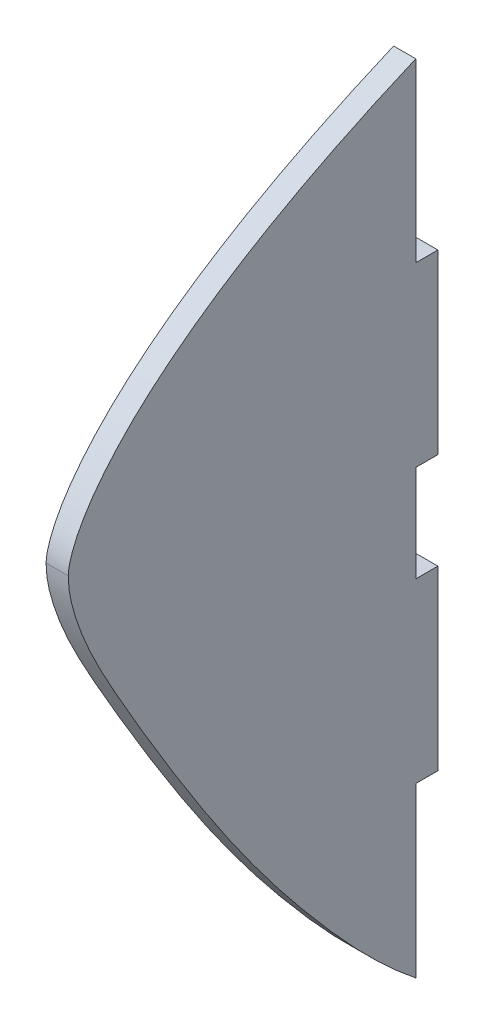
from build123d import *

# Parameters (mm, degrees)
BOSS_EXTRUDE1_DEPTH = 3.175


with BuildPart() as part:
    # Sketch1 → Boss-Extrude1 (new body)
    with BuildSketch(Plane(origin=(38.1, 0, 0), x_dir=(0, 0, -1), z_dir=(1, 0, 0))):
        with BuildLine():
            Line((53.975, 13.934655528), (50.8, 13.934655528))
            Line((50.8, 13.934655528), (50.8, 39.248123167))
            add(Edge.make_bspline(
                [(50.8, 39.248123167), (50.114337, 38.95697122), (45.517089309, 36.98001911), (37.125857024, 33.052669943), (27.830125776, 27.881863583), (20.719091236, 23.242106564), (15.614494654, 19.455138907), (10.786662405, 15.322065366), (6.429542578, 10.752123034), (3.32977957, 6.520652954), (1.7663924, 3.289417246), (1.234577983, 1.629552847), (1.070915718, 0.808496426), (1.022678144, 0.373573946), (1.007771389, 0.114040702), (1.000919428, -0.010571554)],
                knots=[0.920379078, 0.920379078, 0.920379078, 0.920379078, 0.923068011, 0.938443771, 0.95381953, 0.96150741, 0.96919529, 0.97688317, 0.984571049, 0.992258929, 0.996102869, 0.998024839, 0.998985824, 0.999466316, 0.999946809, 0.999946809, 0.999946809, 0.999946809], degree=3))
            add(Edge.make_bspline(
                [(1.000919428, -0.010571554), (1.009921864, -0.277884035), (1.028925425, -0.823363517), (1.10276659, -1.825860568), (1.41675837, -3.59720545), (2.452149912, -7.203198014), (4.557689087, -12.131447527), (7.694251284, -17.873839822), (12.081450574, -25.466402985), (17.732187967, -34.796472344), (24.919918009, -45.768226926), (31.457639598, -54.481002451), (37.047634728, -61.182548528), (42.818130244, -67.680088504), (47.457882264, -72.162847135), (50.8, -74.824969829)],
                knots=[5.1726e-05, 5.1726e-05, 5.1726e-05, 5.1726e-05, 0.001013083, 0.00197444, 0.003897153, 0.00774258, 0.015433433, 0.023124286, 0.030815139, 0.046196845, 0.061578551, 0.076960258, 0.084651111, 0.092341964, 0.107535675, 0.107535675, 0.107535675, 0.107535675], degree=3))
            Line((50.8, -74.824969829), (50.8, -50.696741856))
            Line((50.8, -50.696741856), (53.975, -50.696741856))
            Line((53.975, -50.696741856), (53.975, -25.296741856))
            Line((53.975, -25.296741856), (50.8, -25.296741856))
            Line((50.8, -25.296741856), (50.8, -11.465344472))
            Line((50.8, -11.465344472), (53.975, -11.465344472))
            Line((53.975, -11.465344472), (53.975, 13.934655528))
        make_face()
    extrude(amount=-BOSS_EXTRUDE1_DEPTH)


solid = part.part
